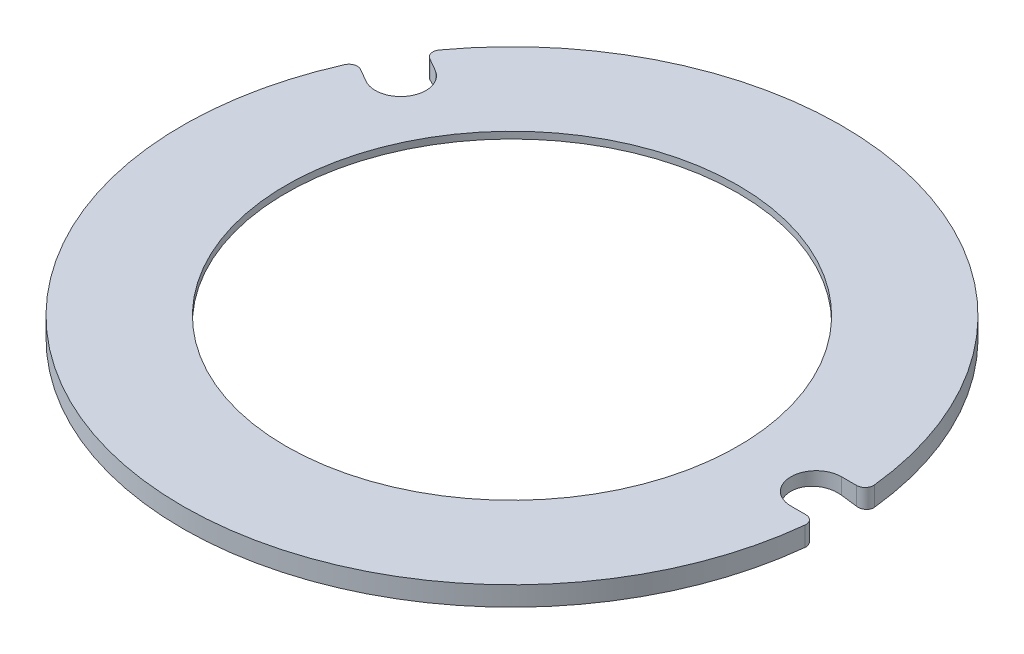
from build123d import *

# Parameters (mm, degrees)
CUT_EXTRUDE2_DEPTH = 276.304225471
FILLET1_R          = 1


with BuildPart() as part:
    # Sketch1 → Revolve1 (revolve)
    with BuildSketch(Plane.XY, mode=Mode.PRIVATE) as revolve1_sk:
        with BuildLine():
            Line((39, 269.722851391), (26.75, 269.722851391))
            Line((26.75, 269.722851391), (26.75, 268.922851391))
            ThreePointArc((26.75, 268.922851391), (32.883573625, 268.241930141), (39, 267.421133234))
            Line((39, 267.421133234), (39, 269.722851391))
        make_face()
    revolve(revolve1_sk.sketch.rotate(Axis((0, 0, 0), (0, 1, 0)), 90), axis=Axis((0, 0, 0), (0, 1, 0)))

    # Sketch2 → Cut-Extrude2 (cut, through all)
    with BuildSketch(Plane(origin=(0, 0, 0), x_dir=(1, 0, 0), z_dir=(0, 1, 0))):
        with BuildLine():
            Line((36, 3), (46, 3))
            ThreePointArc((46, 3), (49, 0), (46, -3))
            Line((46, -3), (36, -3))
            ThreePointArc((36, -3), (33, 0), (36, 3))
        make_face()
        with BuildLine():
            Line((-32.676914536, 15.401923789), (-41.337168574, 20.401923789))
            ThreePointArc((-41.337168574, 20.401923789), (-42.435244785, 24.5), (-38.337168574, 25.598076211))
            Line((-38.337168574, 25.598076211), (-29.676914536, 20.598076211))
            ThreePointArc((-29.676914536, 20.598076211), (-28.578838325, 16.5), (-32.676914536, 15.401923789))
        make_face()
    extrude(amount=CUT_EXTRUDE2_DEPTH, mode=Mode.SUBTRACT)

    # Fillet1
    fillet1_edges = [part.edges().sort_by_distance(p)[0] for p in [
        (38.88444419, 268.571992312, 3),
        (38.88444419, 268.571992312, -3),
        (-32.174916481, 268.571992312, -22.040298307),
        (-35.174916481, 268.571992312, -16.844145884),
    ]]
    fillet(fillet1_edges, radius=FILLET1_R)


solid = part.part
